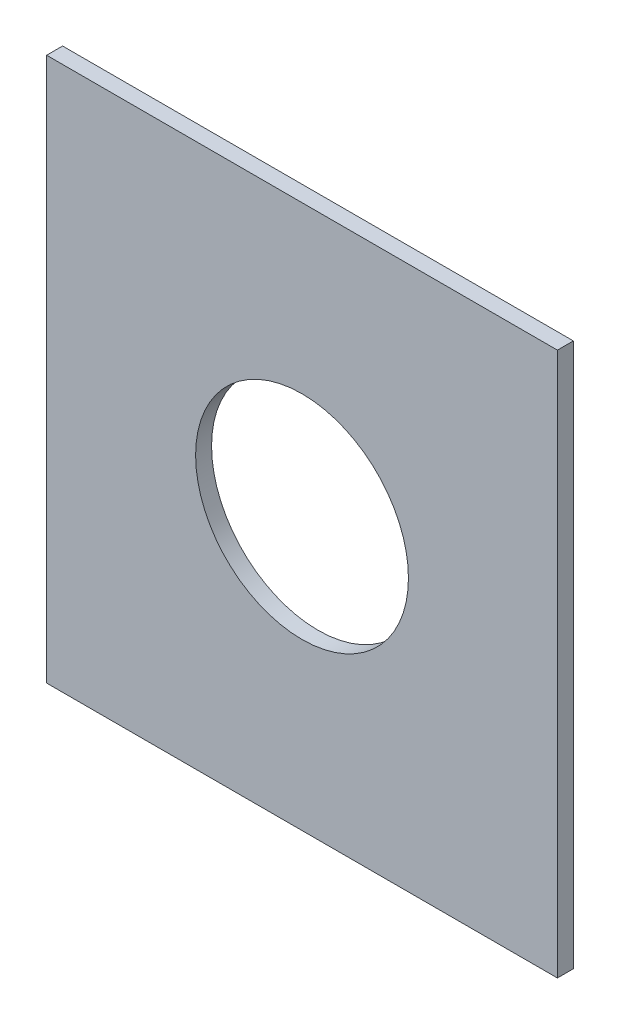
from build123d import *

# Parameters (mm, degrees)
SKETCH1_W           = 480
SKETCH1_H           = 511
BOSS_EXTRUDE1_DEPTH = 15
SKETCH3_R           = 100
CUT_EXTRUDE2_DEPTH  = 15
SKETCH4_R           = 1.5
CUT_EXTRUDE3_DEPTH  = 7
CUT_EXTRUDE4_DEPTH  = 2.3
SKETCH6_R           = 3
CUT_EXTRUDE5_DEPTH  = 7
SKETCH7_R           = 1.5
CUT_EXTRUDE6_DEPTH  = 5


with BuildPart() as part:
    # Sketch1 → Boss-Extrude1 (new body)
    with BuildSketch(Plane.XY):
        Rectangle(SKETCH1_W, SKETCH1_H)
    extrude(amount=BOSS_EXTRUDE1_DEPTH)

    # Sketch3 → Cut-Extrude2 (cut)
    with BuildSketch(Plane(origin=(0, 0, 0), x_dir=(-1, 0, 0), z_dir=(0, 0, -1))):
        Circle(SKETCH3_R)
    extrude(amount=-CUT_EXTRUDE2_DEPTH, mode=Mode.SUBTRACT)

    # Sketch4 → Cut-Extrude3 (cut)
    with BuildSketch(Plane(origin=(0, 0, 0), x_dir=(-1, 0, 0), z_dir=(0, 0, -1))):
        with Locations((22.80945209, 173.254989525)):
            Circle(SKETCH4_R)
        with Locations(Location((-22.80945209, 173.254989525, 0), (0, 0, 180))):
            Circle(SKETCH4_R)
        with Locations((-161.447948306, -66.873929806)):
            Circle(SKETCH4_R)
        with Locations(Location((-138.638496216, -106.381059719, 0), (0, 0, 180))):
            Circle(SKETCH4_R)
        with Locations((138.638496216, -106.381059719)):
            Circle(SKETCH4_R)
        with Locations(Location((161.447948306, -66.873929806, 0), (0, 0, 180))):
            Circle(SKETCH4_R)
    extrude(amount=-CUT_EXTRUDE3_DEPTH, mode=Mode.SUBTRACT)

    # Sketch5 → Cut-Extrude4 (cut)
    with BuildSketch(Plane(origin=(0, 0, 0), x_dir=(-1, 0, 0), z_dir=(0, 0, -1))):
        Polygon((22.80945209, 176.430416006), (20.05945209, 174.842702765), (20.05945209, 171.667276285), (22.80945209, 170.079563045), (25.55945209, 171.667276285), (25.55945209, 174.842702765), align=None)
        Polygon((-20.05945209, 174.842702765), (-20.05945209, 171.667276285), (-22.80945209, 170.079563045), (-25.55945209, 171.667276285), (-25.55945209, 174.842702765), (-22.80945209, 176.430416006), align=None)
        Polygon((-164.197948306, -68.461643046), (-161.447948306, -70.049356286), (-158.697948306, -68.461643046), (-158.697948306, -65.286216566), (-161.447948306, -63.698503325), (-164.197948306, -65.286216566), align=None)
        Polygon((-138.638496216, -109.5564862), (-141.388496216, -107.96877296), (-141.388496216, -104.793346479), (-138.638496216, -103.205633239), (-135.888496216, -104.793346479), (-135.888496216, -107.96877296), align=None)
        Polygon((141.388496216, -107.96877296), (141.388496216, -104.793346479), (138.638496216, -103.205633239), (135.888496216, -104.793346479), (135.888496216, -107.96877296), (138.638496216, -109.5564862), align=None)
        Polygon((164.197948306, -65.286216566), (164.197948306, -68.461643046), (161.447948306, -70.049356286), (158.697948306, -68.461643046), (158.697948306, -65.286216566), (161.447948306, -63.698503325), align=None)
    extrude(amount=-CUT_EXTRUDE4_DEPTH, mode=Mode.SUBTRACT)

    # Sketch6 → Cut-Extrude5 (cut)
    with BuildSketch(Plane(origin=(0, 0, 0), x_dir=(-1, 0, 0), z_dir=(0, 0, -1))):
        with Locations((-156.911542489, 135.010250847)):
            Circle(SKETCH6_R)
    extrude(amount=-CUT_EXTRUDE5_DEPTH, mode=Mode.SUBTRACT)

    # Sketch7 → Cut-Extrude6 (cut)
    with BuildSketch(Plane(origin=(0, 0, 0), x_dir=(-1, 0, 0), z_dir=(0, 0, -1))):
        with Locations((-123.323970382, 168.597822953)):
            Circle(SKETCH7_R)
        with Locations((-190.499114595, 168.597822953)):
            Circle(SKETCH7_R)
        with Locations((-190.499114595, 101.422678741)):
            Circle(SKETCH7_R)
    extrude(amount=-CUT_EXTRUDE6_DEPTH, mode=Mode.SUBTRACT)


solid = part.part
